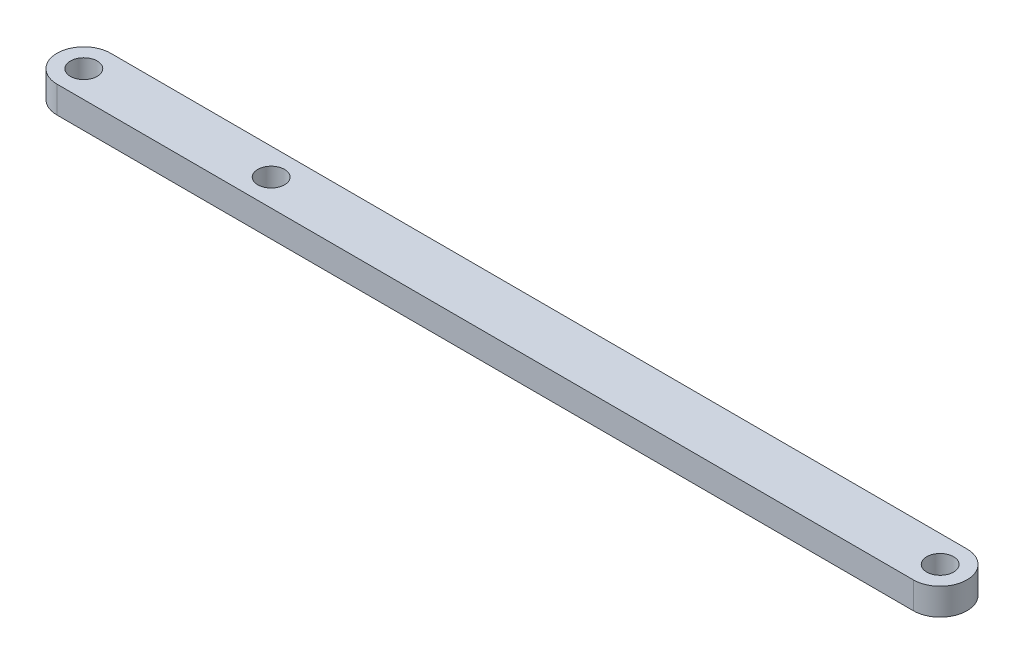
from build123d import *

# Parameters (mm, degrees)
BOSS_EXTRUDE1_DEPTH = 5
CUT_EXTRUDE1_REACH  = 88.258
SKETCH3_R           = 2.5


with BuildPart() as part:
    # Sketch2 → Boss-Extrude1 (new body)
    with BuildSketch(Plane(origin=(0, 0, 0), x_dir=(1, 0, 0), z_dir=(0, 1, 0))):
        with BuildLine():
            Line((-80.680626491, 1.660466244), (79.319373509, 1.44949578))
            ThreePointArc((79.319373509, 1.44949578), (84.312776341, -3.557092695), (79.306187867, -8.550495527))
            Line((79.306187867, -8.550495527), (-80.693812133, -8.339525063))
            ThreePointArc((-80.693812133, -8.339525063), (-85.687214966, -3.332936588), (-80.680626491, 1.660466244))
        make_face()
    extrude(amount=BOSS_EXTRUDE1_DEPTH)

    # Sketch3 → Cut-Extrude1 (cut, up to next)
    with BuildSketch(Plane(origin=(0, 5, 0), x_dir=(1, 0, 0), z_dir=(0, 1, 0)), mode=Mode.PRIVATE) as cut_extrude1_sk1:
        with Locations(Location((-80.687219312, -3.33952941, 0), (0, 0, 270))):
            Circle(SKETCH3_R)
    cut_extrude1_tool1 = extrude(cut_extrude1_sk1.sketch, amount=-CUT_EXTRUDE1_REACH, mode=Mode.PRIVATE) & part.part
    # Sketch3 → Cut-Extrude1 (cut, up to next)
    with BuildSketch(Plane(origin=(0, 5, 0), x_dir=(1, 0, 0), z_dir=(0, 1, 0)), mode=Mode.PRIVATE) as cut_extrude1_sk2:
        with Locations(Location((79.312780688, -3.550499874, 0), (0, 0, 270))):
            Circle(SKETCH3_R)
    cut_extrude1_tool2 = extrude(cut_extrude1_sk2.sketch, amount=-CUT_EXTRUDE1_REACH, mode=Mode.PRIVATE) & part.part
    # Sketch3 → Cut-Extrude1 (cut, up to next)
    with BuildSketch(Plane(origin=(0, 5, 0), x_dir=(1, 0, 0), z_dir=(0, 1, 0)), mode=Mode.PRIVATE) as cut_extrude1_sk3:
        with Locations(Location((-45.687249738, -3.385679158, 0), (0, 0, 270))):
            Circle(SKETCH3_R)
    cut_extrude1_tool3 = extrude(cut_extrude1_sk3.sketch, amount=-CUT_EXTRUDE1_REACH, mode=Mode.PRIVATE) & part.part
    add(cut_extrude1_tool1.solids().sort_by_distance((-80.687219, 5, 3.339529))[0], mode=Mode.SUBTRACT)
    add(cut_extrude1_tool2.solids().sort_by_distance((79.312781, 5, 3.5505))[0], mode=Mode.SUBTRACT)
    add(cut_extrude1_tool3.solids().sort_by_distance((-45.68725, 5, 3.385679))[0], mode=Mode.SUBTRACT)


solid = part.part
